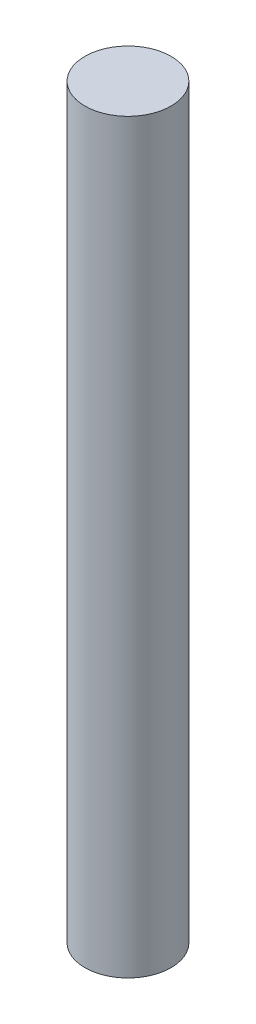
from build123d import *

# Parameters (mm, degrees)
SKETCH1_R           = 1.5875
BOSS_EXTRUDE1_DEPTH = 27.5


with BuildPart() as part:
    # Sketch1 → Boss-Extrude1 (new body)
    with BuildSketch(Plane(origin=(0, 0, 0), x_dir=(1, 0, 0), z_dir=(0, 1, 0))):
        with Locations(Location((0, 0, 0), (0, 0, 270))):
            Circle(SKETCH1_R)
    extrude(amount=BOSS_EXTRUDE1_DEPTH)


solid = part.part
